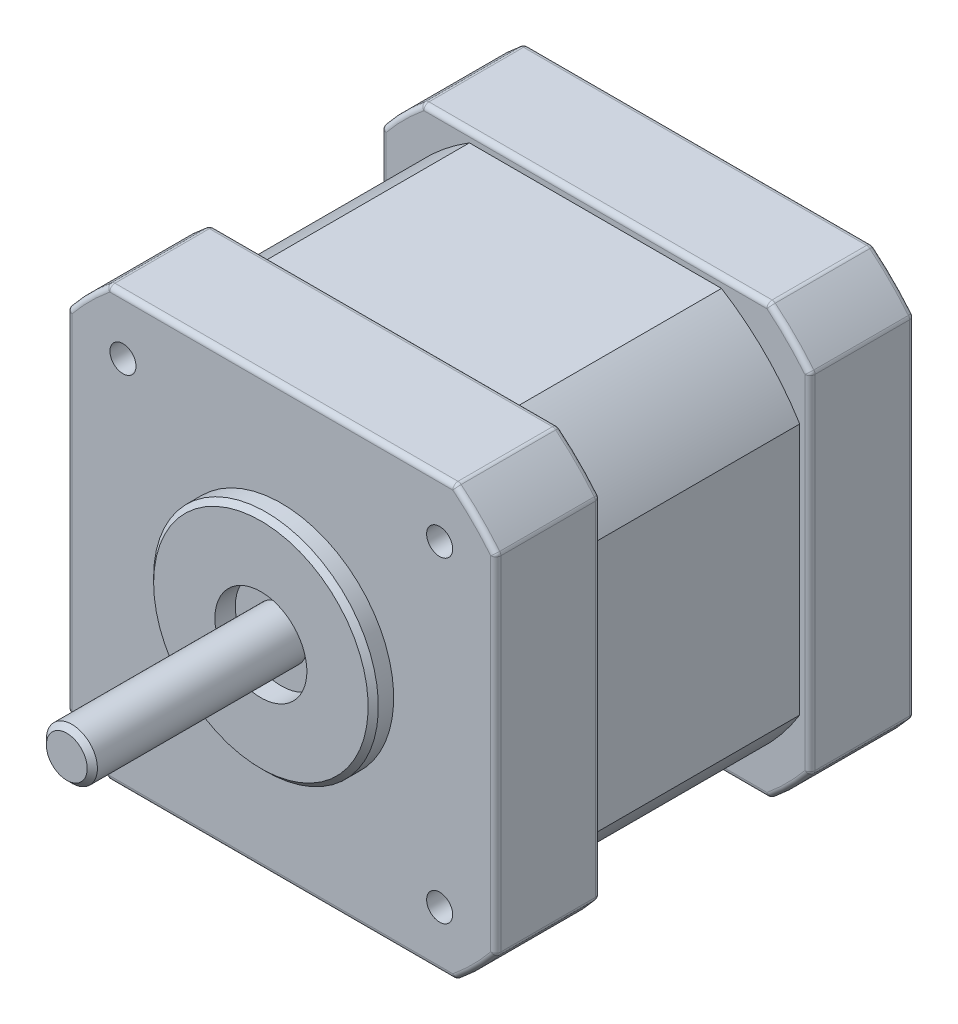
from build123d import *

# Parameters (mm, degrees)
EXTRUDE_START       = -21
EXTRUDE_1_DEPTH     = 10.25
EXTRUDE_START_2     = -51.75
EXTRUDE_2_DEPTH     = 10.25
EXTRUDE_START_3     = -31.25
EXTRUDE_3_DEPTH     = 20.5
CUT_EXTRUDE_START   = -21
SKETCH_7_R          = 1.275
CUT_EXTRUDE_4_DEPTH = 5
FILLET_1_R          = 0.5
FILLET_2_R          = 0.5


with BuildPart() as part:
    # 草图3 → 旋转1 (revolve)
    with BuildSketch(Plane(origin=(0, 0, 0), x_dir=(0, 0, -1), z_dir=(1, 0, 0)), mode=Mode.PRIVATE) as revolve_1_sk:
        Polygon((0, 2), (0, 0), (21, 0), (21, 2.5), (0.5, 2.5), align=None)
        Polygon((19, 4.5), (21, 4.5), (21, 11), (19.5, 11), (19, 10.5), align=None)
    revolve(revolve_1_sk.sketch.rotate(Axis((0, 0, -21), (0, 0, 1)), 90), axis=Axis((0, 0, -21), (0, 0, 1)))

    # 草图4 → 凸台-拉伸1 (add)
    with BuildSketch(Plane.XY.offset(EXTRUDE_START)):
        with BuildLine():
            Line((16.970562748, 21), (-16.970562748, 21))
            ThreePointArc((-16.970562748, 21), (-19.091883092, 19.091883092), (-21, 16.970562748))
            Line((-21, 16.970562748), (-21, -16.970562748))
            ThreePointArc((-21, -16.970562748), (-19.091883092, -19.091883092), (-16.970562748, -21))
            Line((-16.970562748, -21), (16.970562748, -21))
            ThreePointArc((16.970562748, -21), (19.091883092, -19.091883092), (21, -16.970562748))
            Line((21, -16.970562748), (21, 16.970562748))
            ThreePointArc((21, 16.970562748), (19.091883092, 19.091883092), (16.970562748, 21))
        make_face()
    extrude(amount=-EXTRUDE_1_DEPTH)



with BuildPart() as body_2:
    # 草图4<2> → 凸台-拉伸2 (new body)
    with BuildSketch(Plane.XY.offset(EXTRUDE_START_2)):
        with BuildLine():
            Line((16.970562748, 21), (-16.970562748, 21))
            ThreePointArc((-16.970562748, 21), (-19.091883092, 19.091883092), (-21, 16.970562748))
            Line((-21, 16.970562748), (-21, -16.970562748))
            ThreePointArc((-21, -16.970562748), (-19.091883092, -19.091883092), (-16.970562748, -21))
            Line((-16.970562748, -21), (16.970562748, -21))
            ThreePointArc((16.970562748, -21), (19.091883092, -19.091883092), (21, -16.970562748))
            Line((21, -16.970562748), (21, 16.970562748))
            ThreePointArc((21, 16.970562748), (19.091883092, 19.091883092), (16.970562748, 21))
        make_face()
    extrude(amount=-EXTRUDE_2_DEPTH)


with BuildPart() as part_1:
    add(part.part)

    add(body_2.part)  # 凸台-拉伸3 merges body 2
    # 草图5 → 凸台-拉伸3 (add)
    with BuildSketch(Plane.XY.offset(EXTRUDE_START_3)):
        with BuildLine():
            Line((20, -12.338962679), (20, 12.338962679))
            ThreePointArc((20, 12.338962679), (16.617009358, 16.617009358), (12.338962679, 20))
            Line((12.338962679, 20), (-12.338962679, 20))
            ThreePointArc((-12.338962679, 20), (-16.617009358, 16.617009358), (-20, 12.338962679))
            Line((-20, 12.338962679), (-20, -12.338962679))
            ThreePointArc((-20, -12.338962679), (-16.617009358, -16.617009358), (-12.338962679, -20))
            Line((-12.338962679, -20), (12.338962679, -20))
            ThreePointArc((12.338962679, -20), (16.617009358, -16.617009358), (20, -12.338962679))
        make_face()
    extrude(amount=-EXTRUDE_3_DEPTH)

    # 草图7 → 切除-拉伸4 (cut)
    with BuildSketch(Plane.XY.offset(CUT_EXTRUDE_START)):
        with Locations((-15.5, 15.5)):
            Circle(SKETCH_7_R)
        with Locations((15.5, 15.5)):
            Circle(SKETCH_7_R)
        with Locations((15.5, -15.5)):
            Circle(SKETCH_7_R)
        with Locations((-15.5, -15.5)):
            Circle(SKETCH_7_R)
    extrude(amount=-CUT_EXTRUDE_4_DEPTH, mode=Mode.SUBTRACT)

    # 圆角1
    fillet_1_edges = [part_1.edges().sort_by_distance(p)[0] for p in [
        (19.091883092, 19.091883092, -21),
        (0, 21, -21),
        (-19.091883092, 19.091883092, -21),
        (-21, 0, -21),
        (-19.091883092, -19.091883092, -21),
        (0, -21, -21),
        (19.091883092, -19.091883092, -21),
        (21, 0, -21),
        (19.091883092, 19.091883092, -31.25),
        (16.970562748, 21, -26.125),
        (21, 0, -31.25),
        (21, 16.970562748, -26.125),
        (19.091883092, -19.091883092, -31.25),
        (21, -16.970562748, -26.125),
        (0, -21, -31.25),
        (16.970562748, -21, -26.125),
        (-19.091883092, -19.091883092, -31.25),
        (-16.970562748, -21, -26.125),
        (-21, 0, -31.25),
        (-21, -16.970562748, -26.125),
        (-19.091883092, 19.091883092, -31.25),
        (-21, 16.970562748, -26.125),
        (0, 21, -31.25),
        (-16.970562748, 21, -26.125),
    ]]
    fillet(fillet_1_edges, radius=FILLET_1_R)

    # 圆角2
    fillet_2_edges = [part_1.edges().sort_by_distance(p)[0] for p in [
        (19.091883092, 19.091883092, -62),
        (16.970562748, 21, -56.875),
        (21, 0, -62),
        (21, 16.970562748, -56.875),
        (19.091883092, -19.091883092, -62),
        (21, -16.970562748, -56.875),
        (0, -21, -62),
        (16.970562748, -21, -56.875),
        (-19.091883092, -19.091883092, -62),
        (-16.970562748, -21, -56.875),
        (-21, 0, -62),
        (-21, -16.970562748, -56.875),
        (-19.091883092, 19.091883092, -62),
        (-21, 16.970562748, -56.875),
        (0, 21, -62),
        (-16.970562748, 21, -56.875),
        (19.091883092, 19.091883092, -51.75),
        (0, 21, -51.75),
        (-19.091883092, 19.091883092, -51.75),
        (-21, 0, -51.75),
        (-19.091883092, -19.091883092, -51.75),
        (0, -21, -51.75),
        (19.091883092, -19.091883092, -51.75),
        (21, 0, -51.75),
    ]]
    fillet(fillet_2_edges, radius=FILLET_2_R)


solid = part_1.part
